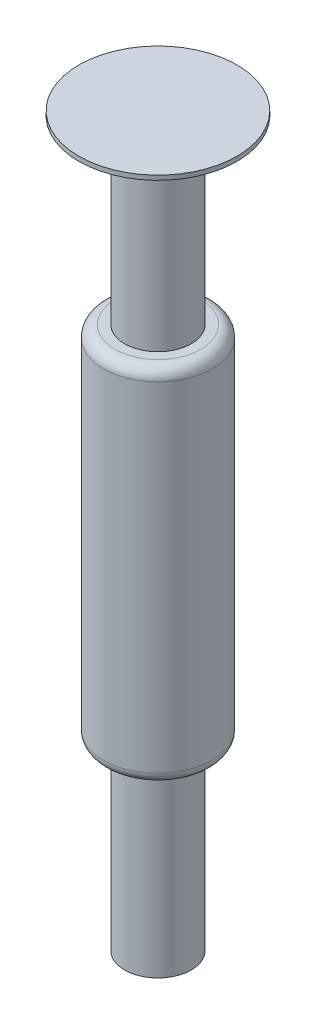
from build123d import *

# Parameters (mm, degrees)
SKETCH1_R           = 4.8
BOSS_EXTRUDE2_DEPTH = 32
SKETCH2_R           = 2.95
BOSS_EXTRUDE3_DEPTH = 16
BOSS_EXTRUDE4_START = 16
SKETCH3_R           = 2.95
BOSS_EXTRUDE4_DEPTH = 16
FILLET1_R           = 1
SKETCH4_R           = 7
BOSS_EXTRUDE5_DEPTH = 0.4


with BuildPart() as part:
    # Sketch1 → Boss-Extrude2 (new body)
    with BuildSketch(Plane(origin=(0, 0, 0), x_dir=(1, 0, 0), z_dir=(0, 1, 0))):
        with Locations(Location((0, 0, 0), (0, 0, 270))):
            Circle(SKETCH1_R)
    extrude(amount=BOSS_EXTRUDE2_DEPTH)

    # Sketch2 → Boss-Extrude3 (add)
    with BuildSketch(Plane(origin=(0, 32, 0), x_dir=(1, 0, 0), z_dir=(0, 1, 0))):
        with Locations(Location((0, 0, 0), (0, 0, 270))):
            Circle(SKETCH2_R)
    extrude(amount=BOSS_EXTRUDE3_DEPTH)

    # Sketch3 → Boss-Extrude4 (add)
    with BuildSketch(Plane.XZ.offset(BOSS_EXTRUDE4_START)):
        with Locations(Location((0, 0, 0), (0, 0, 90))):
            Circle(SKETCH3_R)
    extrude(amount=-BOSS_EXTRUDE4_DEPTH)

    # Fillet1
    fillet1_edges = [part.edges().sort_by_distance(p)[0] for p in [
        (0, 0, -4.8),
        (0, 32, -4.8),
    ]]
    fillet(fillet1_edges, radius=FILLET1_R)

    # Sketch4 → Boss-Extrude5 (add)
    with BuildSketch(Plane(origin=(0, 48, 0), x_dir=(1, 0, 0), z_dir=(0, 1, 0))):
        with Locations(Location((0, 0, 0), (0, 0, 270))):
            Circle(SKETCH4_R)
    extrude(amount=BOSS_EXTRUDE5_DEPTH)


solid = part.part
